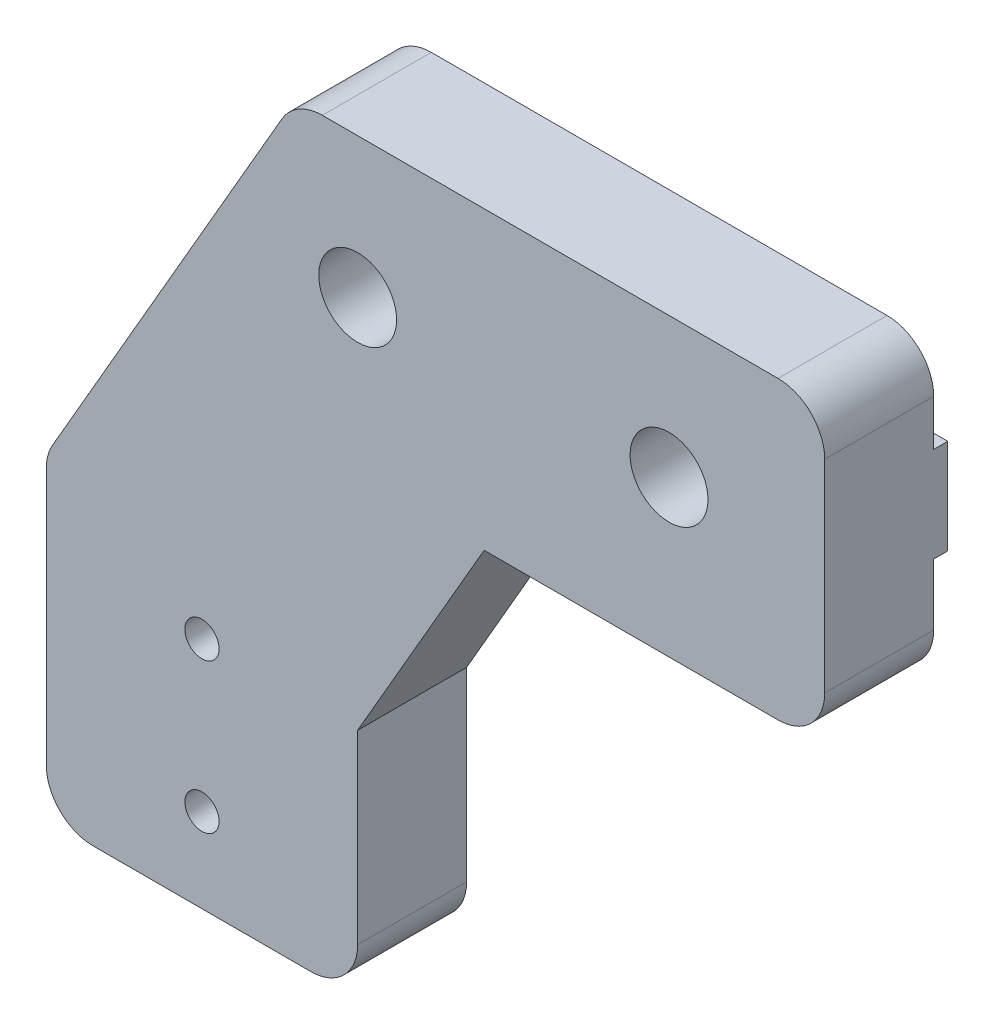
from build123d import *

# Parameters (mm, degrees)
SKETCH1_R           = 2.5
SKETCH1_R_2         = 1.1
BOSS_EXTRUDE1_DEPTH = 7
BOSS_EXTRUDE2_REACH = 71.663
SKETCH2_W           = 0.9
SKETCH2_H           = 6.1
CUT_EXTRUDE1_REACH  = 71.663
SKETCH3_R           = 2.5


with BuildPart() as part:
    # Sketch1 → Boss-Extrude1 (new body)
    with BuildSketch(Plane.XY):
        with BuildLine():
            Line((3, 0), (17, 0))
            ThreePointArc((17, 0), (19.121320344, 0.878679656), (20, 3))
            Line((20, 3), (20, 14.92820323))
            Line((20, 14.92820323), (28.124355653, 29))
            Line((28.124355653, 29), (47, 29))
            ThreePointArc((47, 29), (49.121320344, 29.878679656), (50, 32))
            Line((50, 32), (50, 45))
            ThreePointArc((50, 45), (49.121320344, 47.121320344), (47, 48))
            Line((47, 48), (17.732050808, 48))
            ThreePointArc((17.732050808, 48), (16.232050808, 47.598076211), (15.133974596, 46.5))
            Line((15.133974596, 46.5), (0.401923789, 20.983339502))
            ThreePointArc((0.401923789, 20.983339502), (0.102222521, 20.259796637), (0, 19.483339502))
            Line((0, 19.483339502), (0, 3))
            ThreePointArc((0, 3), (0.878679656, 0.878679656), (3, 0))
        make_face()
        with Locations((20, 39)):
            Circle(SKETCH1_R, mode=Mode.SUBTRACT)
        with Locations((40, 39)):
            Circle(SKETCH1_R, mode=Mode.SUBTRACT)
        with Locations((10, 5.4)):
            Circle(SKETCH1_R_2, mode=Mode.SUBTRACT)
        with Locations((10, 15)):
            Circle(SKETCH1_R_2, mode=Mode.SUBTRACT)
    extrude(amount=BOSS_EXTRUDE1_DEPTH)

    # Boss-Extrude2: up to this plane
    boss_extrude2_end = Plane(origin=(15.133974596, 46.5, 7), z_dir=(0.8660254037844399, -0.4999999999999978, 0))
    # Sketch2 → Boss-Extrude2 (add, up to the surface)
    with BuildSketch(Plane(origin=(50, 0, 0), x_dir=(0, 0, -1), z_dir=(1, 0, 0)), mode=Mode.PRIVATE) as boss_extrude2_sk1:
        with Locations((0.45, 39)):
            Rectangle(SKETCH2_W, SKETCH2_H)
    boss_extrude2_tool1 = split(extrude(boss_extrude2_sk1.sketch, amount=-BOSS_EXTRUDE2_REACH, mode=Mode.PRIVATE), bisect_by=boss_extrude2_end, keep=Keep.BOTH, mode=Mode.PRIVATE)
    add(boss_extrude2_tool1.solids().sort_by_distance((50, 39, -0.45))[0])

    # Sketch3 → Cut-Extrude1 (cut, up to next)
    with BuildSketch(Plane.XY, mode=Mode.PRIVATE) as cut_extrude1_sk1:
        with Locations((20, 39)):
            Circle(SKETCH3_R)
    cut_extrude1_tool1 = extrude(cut_extrude1_sk1.sketch, amount=-CUT_EXTRUDE1_REACH, mode=Mode.PRIVATE) & part.part
    # Sketch3 → Cut-Extrude1 (cut, up to next)
    with BuildSketch(Plane.XY, mode=Mode.PRIVATE) as cut_extrude1_sk2:
        with Locations((40, 39)):
            Circle(SKETCH3_R)
    cut_extrude1_tool2 = extrude(cut_extrude1_sk2.sketch, amount=-CUT_EXTRUDE1_REACH, mode=Mode.PRIVATE) & part.part
    add(cut_extrude1_tool1.solids().sort_by_distance((20, 39, 0))[0], mode=Mode.SUBTRACT)
    add(cut_extrude1_tool2.solids().sort_by_distance((40, 39, 0))[0], mode=Mode.SUBTRACT)


solid = part.part
